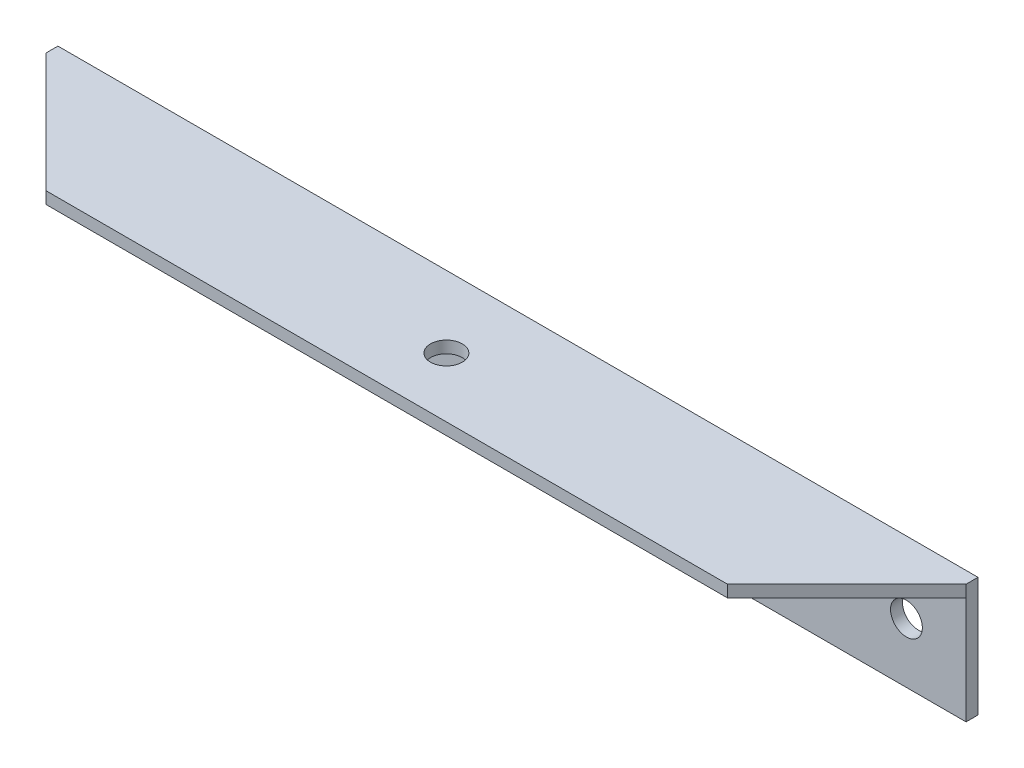
from build123d import *

# Parameters (mm, degrees)
SKETCH1_W                = 231.4
SKETCH1_H                = 30
BOSS_EXTRUDE1_DEPTH      = 3
BOSS_EXTRUDE2_DEPTH      = 3
F_8_0_8_DIAMETER_HOLE1_D = 8
F_8_0_8_DIAMETER_HOLE2_D = 8


with BuildPart() as part:
    # Sketch1 → Boss-Extrude1 (new body)
    with BuildSketch(Plane.XY):
        with Locations((0, -15)):
            Rectangle(SKETCH1_W, SKETCH1_H)
    extrude(amount=BOSS_EXTRUDE1_DEPTH)

    # Sketch3 → Boss-Extrude2 (add)
    with BuildSketch(Plane(origin=(0, 0, 0), x_dir=(1, 0, 0), z_dir=(0, 1, 0))):
        Polygon((-85.7, -33), (85.7, -33), (115.7, -3), (-115.7, -3), align=None)
    extrude(amount=-BOSS_EXTRUDE2_DEPTH)

    # Ø8.0 (8) Diameter Hole1 (through all)
    with Locations(Plane(origin=(0, 0, 0), x_dir=(-1, 0, 0), z_dir=(0, 0, -1))):
        with Locations((100.7, -15), (-100.7, -15)):
            Hole(F_8_0_8_DIAMETER_HOLE1_D / 2)

    # Ø8.0 (8) Diameter Hole2 (through all)
    with Locations(Plane(origin=(0, -3, 0), x_dir=(-1, 0, 0), z_dir=(0, -1, 0))):
        with Locations((0, -18)):
            Hole(F_8_0_8_DIAMETER_HOLE2_D / 2)


solid = part.part
